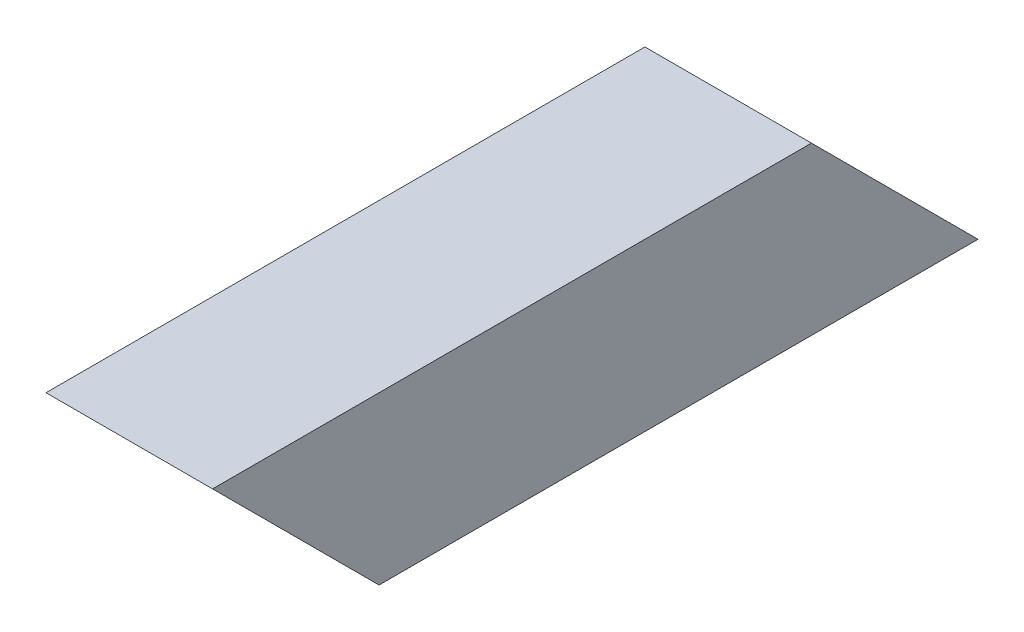
from build123d import *

# Parameters (mm, degrees)
SKETCH1_W           = 25.4
SKETCH1_H           = 25.4
SKETCH1_W_2         = 19.05
SKETCH1_H_2         = 19.05
BOSS_EXTRUDE1_DEPTH = 116.743329574
CUT_EXTRUDE1_DEPTH  = 123.144688792


with BuildPart() as part:
    # Sketch1 → Boss-Extrude1 (new body)
    with BuildSketch(Plane.XY):
        with Locations((-12.7, 12.7)):
            Rectangle(SKETCH1_W, SKETCH1_H)
        with Locations((-12.7, 12.7)):
            Rectangle(SKETCH1_W_2, SKETCH1_H_2, mode=Mode.SUBTRACT)
    extrude(amount=BOSS_EXTRUDE1_DEPTH)

    # Sketch2 → Cut-Extrude1 (cut, through all)
    with BuildSketch(Plane(origin=(0, 0, 0), x_dir=(0, 0, -1), z_dir=(1, 0, 0))):
        Polygon((-116.743329574, 25.4), (-91.343329574, 0), (-116.743329574, 0), align=None)
        Polygon((0, 0), (-25.4, 25.4), (0, 25.4), align=None)
    extrude(amount=-CUT_EXTRUDE1_DEPTH, mode=Mode.SUBTRACT)


solid = part.part
